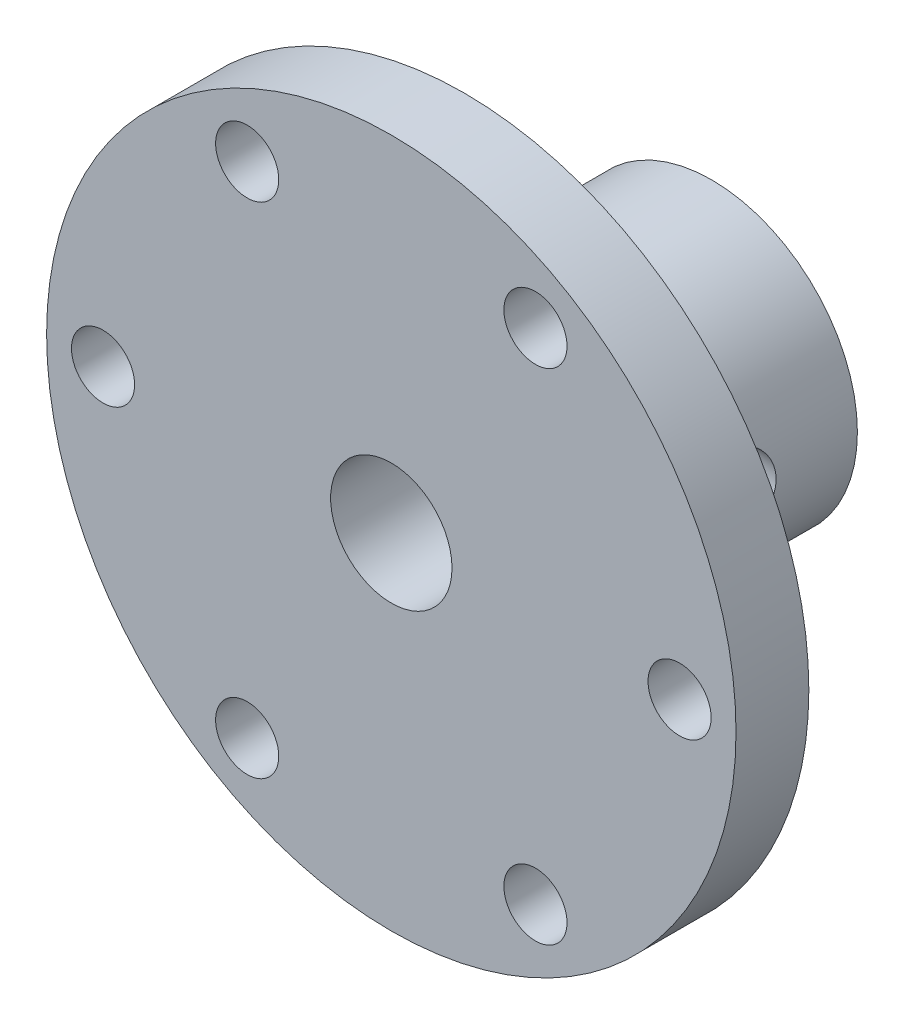
from build123d import *

# Parameters (mm, degrees)
SKETCH_1_R               = 28.4
EXTRUDE_1_DEPTH          = 6
SKETCH_2_R               = 12
EXTRUDE_2_DEPTH          = 20.4
CUT_EXTRUDE_1_DEPTH      = 46.047530454
CUT_EXTRUDE_1_DEPTH_BACK = 46.047530454
SKETCH_3_R               = 5
SKETCH_5_W               = 3.5
SKETCH_5_H               = 12
SKETCH_7_R               = 2.6
CUT_EXTRUDE_2_DEPTH      = 46.047530499
PATTERN_CIRCULAR_1_COUNT = 6


with BuildPart() as part:
    # ｽｹｯﾁ1 → ﾎﾞｽ - 押し出し1 (new body)
    with BuildSketch(Plane.XY):
        Circle(SKETCH_1_R)
    extrude(amount=EXTRUDE_1_DEPTH)

    # ｽｹｯﾁ2 → ﾎﾞｽ - 押し出し2 (add)
    with BuildSketch(Plane.XY):
        Circle(SKETCH_2_R)
    extrude(amount=-EXTRUDE_2_DEPTH)

    # ｽｹｯﾁ3 → ｶｯﾄ - 押し出し1 (cut, two sides: drawn at the far end of the back side and taken through both)
    with BuildSketch(Plane.XY.offset(-CUT_EXTRUDE_1_DEPTH_BACK)):
        Circle(SKETCH_3_R)
    extrude(amount=CUT_EXTRUDE_1_DEPTH + CUT_EXTRUDE_1_DEPTH_BACK, mode=Mode.SUBTRACT)

    # ｽｹｯﾁ5 → M6 すきま穴1 (revolve, cut)
    with BuildSketch(Plane(origin=(0, 0, -10.2), x_dir=(0, 0, 1), z_dir=(0, 1, 0))):
        with Locations((1.75, 6)):
            Rectangle(SKETCH_5_W, SKETCH_5_H)
    revolve(axis=Axis((-6.35, 0, -10.2), (1, 0, 0)), mode=Mode.SUBTRACT)

    # ｽｹｯﾁ7 → ｶｯﾄ - 押し出し2 (cut, symmetric)
    with BuildSketch(Plane.XY):
        with Locations((23.75, 0)):
            Circle(SKETCH_7_R)
    cut_extrude_2 = extrude(amount=CUT_EXTRUDE_2_DEPTH, both=True, mode=Mode.SUBTRACT)

    # 円形ﾊﾟﾀｰﾝ1: ｶｯﾄ - 押し出し2 ×6 about axis
    pattern_circular_1_axis = Axis((0, 0, 0), (0, 0, 1))
    for i in range(1, PATTERN_CIRCULAR_1_COUNT):
        add(cut_extrude_2.rotate(pattern_circular_1_axis, i * 360 / PATTERN_CIRCULAR_1_COUNT), mode=Mode.SUBTRACT)


solid = part.part
